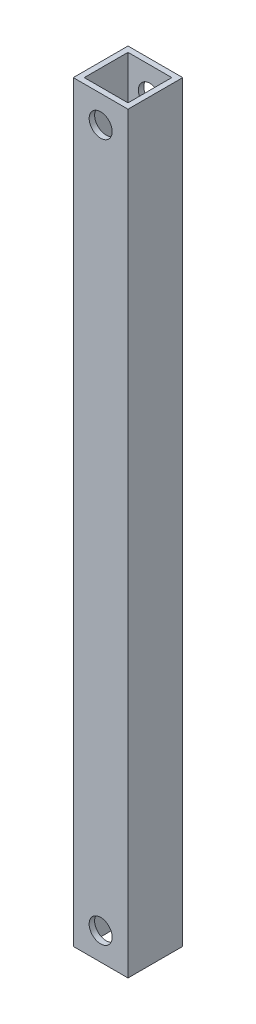
from build123d import *

# Parameters (mm, degrees)
SKETCH_1_W          = 10
SKETCH_1_H          = 10
SKETCH_1_W_2        = 8
SKETCH_1_H_2        = 8
EXTRUDE_1_DEPTH     = 137.5
CUT_EXTRUDE_1_REACH = 139.954
SKETCH_2_R          = 2.1


with BuildPart() as part:
    # ｽｹｯﾁ1 → 押し出し-薄板1 (new body)
    with BuildSketch(Plane(origin=(0, 0, 0), x_dir=(1, 0, 0), z_dir=(0, 1, 0))):
        Rectangle(SKETCH_1_W, SKETCH_1_H)
        Rectangle(SKETCH_1_W_2, SKETCH_1_H_2, mode=Mode.SUBTRACT)
    extrude(amount=EXTRUDE_1_DEPTH)

    # ｶｯﾄ - 押し出し1: up to this face of the body (flat: up to its plane)
    cut_extrude_1_end = Plane(part.part.faces().sort_by_distance((0, 68.75, -5))[0])
    # ｽｹｯﾁ2 → ｶｯﾄ - 押し出し1 (cut, up to the picked face)
    with BuildSketch(Plane.XY.offset(5), mode=Mode.PRIVATE) as cut_extrude_1_sk1:
        with Locations((0, 132.5)):
            Circle(SKETCH_2_R)
    cut_extrude_1_tool1 = split(extrude(cut_extrude_1_sk1.sketch, amount=-CUT_EXTRUDE_1_REACH, mode=Mode.PRIVATE), bisect_by=cut_extrude_1_end, keep=Keep.BOTH, mode=Mode.PRIVATE)
    # ｽｹｯﾁ2 → ｶｯﾄ - 押し出し1 (cut, up to the picked face)
    with BuildSketch(Plane.XY.offset(5), mode=Mode.PRIVATE) as cut_extrude_1_sk2:
        with Locations(Location((0, 5, 0), (0, 0, 180))):
            Circle(SKETCH_2_R)
    cut_extrude_1_tool2 = split(extrude(cut_extrude_1_sk2.sketch, amount=-CUT_EXTRUDE_1_REACH, mode=Mode.PRIVATE), bisect_by=cut_extrude_1_end, keep=Keep.BOTH, mode=Mode.PRIVATE)
    add(cut_extrude_1_tool1.solids().sort_by(Axis((0, 132.5, 5), (0, 0, -1)))[0], mode=Mode.SUBTRACT)
    add(cut_extrude_1_tool2.solids().sort_by(Axis((0, 5, 5), (0, 0, -1)))[0], mode=Mode.SUBTRACT)


solid = part.part
